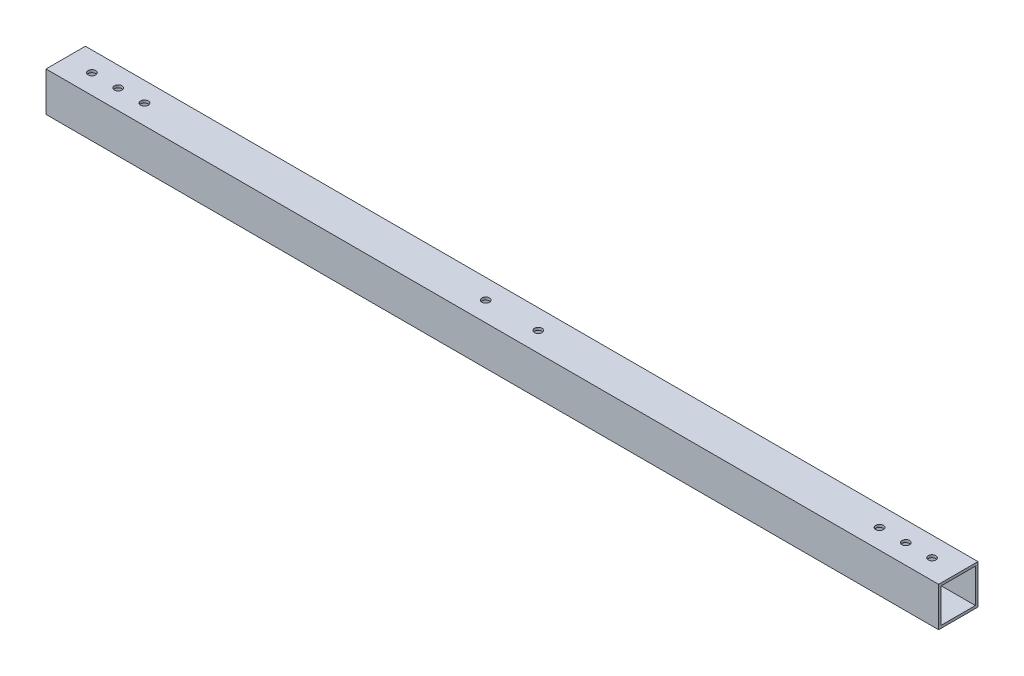
from build123d import *

# Parameters (mm, degrees)
SKETCH_1_W          = 15
SKETCH_1_H          = 15
SKETCH_1_W_2        = 13
SKETCH_1_H_2        = 13
EXTRUDE_1_DEPTH     = 340
SKETCH_2_R          = 1.45
CUT_EXTRUDE_1_DEPTH = 341.413351677
SKETCH_3_R          = 1.45
CUT_EXTRUDE_2_DEPTH = 341.413351677


with BuildPart() as part:
    # 草图1 → 凸台-拉伸1 (new body)
    with BuildSketch(Plane(origin=(0, 0, 0), x_dir=(0, 0, -1), z_dir=(1, 0, 0))):
        Rectangle(SKETCH_1_W, SKETCH_1_H)
        Rectangle(SKETCH_1_W_2, SKETCH_1_H_2, mode=Mode.SUBTRACT)
    extrude(amount=EXTRUDE_1_DEPTH)

    # 草图2 → 切除-拉伸1 (cut, through all)
    with BuildSketch(Plane.XZ.offset(7.5)):
        with Locations(Location((160, 0, 0), (0, 0, 270))):
            Circle(SKETCH_2_R)
        with Locations(Location((180, 0, 0), (0, 0, 90))):
            Circle(SKETCH_2_R)
    extrude(amount=-CUT_EXTRUDE_1_DEPTH, mode=Mode.SUBTRACT)

    # 草图3 → 切除-拉伸2 (cut, through all)
    with BuildSketch(Plane(origin=(0, 7.5, 0), x_dir=(1, 0, 0), z_dir=(0, 1, 0))):
        with Locations(Location((180, 0, 0), (0, 0, 270))):
            Circle(SKETCH_3_R)
        with Locations(Location((160, 0, 0), (0, 0, 90))):
            Circle(SKETCH_3_R)
        with Locations(Location((20, 0, 0), (0, 0, 270))):
            Circle(SKETCH_3_R)
        with Locations(Location((30, 0, 0), (0, 0, 270))):
            Circle(SKETCH_3_R)
        with Locations(Location((10, 0, 0), (0, 0, 270))):
            Circle(SKETCH_3_R)
        with Locations(Location((330, 0, 0), (0, 0, 270))):
            Circle(SKETCH_3_R)
        with Locations(Location((310, 0, 0), (0, 0, 270))):
            Circle(SKETCH_3_R)
        with Locations(Location((320, 0, 0), (0, 0, 270))):
            Circle(SKETCH_3_R)
    extrude(amount=-CUT_EXTRUDE_2_DEPTH, mode=Mode.SUBTRACT)


solid = part.part
